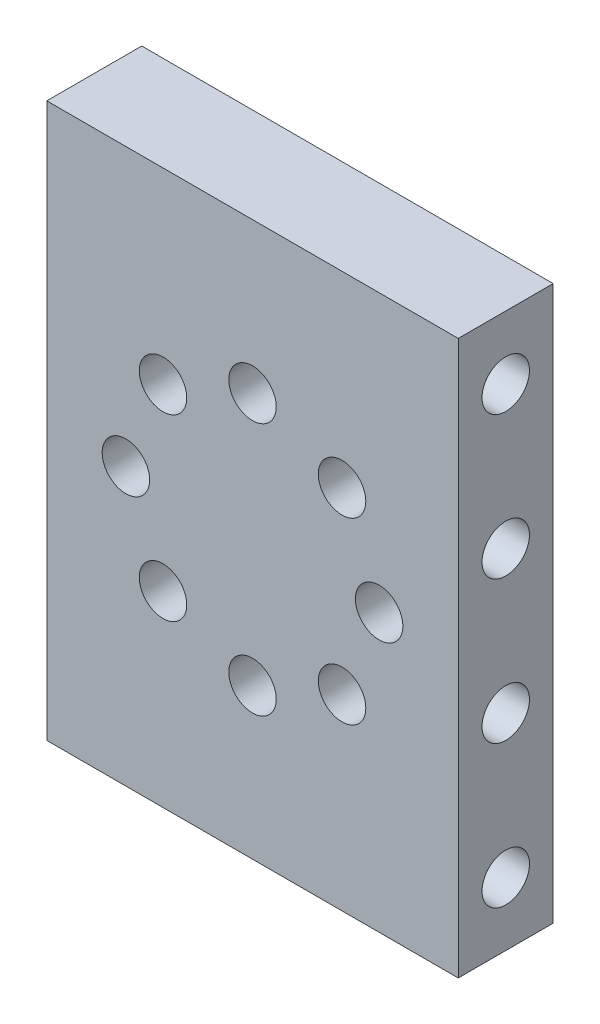
from build123d import *

# Parameters (mm, degrees)
SKETCH_1_W          = 52
SKETCH_1_H          = 70
EXTRUDE_1_DEPTH     = 12
SKETCH_2_R          = 3
CUT_EXTRUDE_1_DEPTH = 10
CUT_EXTRUDE_START   = -10
SKETCH_3_R          = 3
CUT_EXTRUDE_2_DEPTH = 10
SKETCH_4_R          = 3
CUT_EXTRUDE_3_DEPTH = 12


with BuildPart() as part:
    # 草图1 → 凸台-拉伸1 (new body)
    with BuildSketch(Plane.XY):
        Rectangle(SKETCH_1_W, SKETCH_1_H)
    extrude(amount=EXTRUDE_1_DEPTH)

    # 草图2 → 切除-拉伸1 (cut)
    with BuildSketch(Plane.ZY.offset(26)):
        with Locations((6, 27)):
            Circle(SKETCH_2_R)
        with Locations((6, 9)):
            Circle(SKETCH_2_R)
        with Locations((6, -9)):
            Circle(SKETCH_2_R)
        with Locations((6, -27)):
            Circle(SKETCH_2_R)
    extrude(amount=-CUT_EXTRUDE_1_DEPTH, mode=Mode.SUBTRACT)

    # 草图3 → 切除-拉伸2 (cut)
    with BuildSketch(Plane(origin=(26, 0, 0), x_dir=(0, 0, -1), z_dir=(1, 0, 0)).offset(CUT_EXTRUDE_START)):
        with Locations(Location((-6, 27, 0), (0, 0, 180))):
            Circle(SKETCH_3_R)
        with Locations(Location((-6, 9, 0), (0, 0, 180))):
            Circle(SKETCH_3_R)
        with Locations(Location((-6, -9, 0), (0, 0, 180))):
            Circle(SKETCH_3_R)
        with Locations(Location((-6, -27, 0), (0, 0, 180))):
            Circle(SKETCH_3_R)
    extrude(amount=CUT_EXTRUDE_2_DEPTH, mode=Mode.SUBTRACT)

    # 草图4 → 切除-拉伸3 (cut)
    with BuildSketch(Plane.XY.offset(12)):
        with Locations((16, 0)):
            Circle(SKETCH_4_R)
        with Locations((11.313708499, -11.313708499)):
            Circle(SKETCH_4_R)
        with Locations((0, -16)):
            Circle(SKETCH_4_R)
        with Locations((-11.313708499, -11.313708499)):
            Circle(SKETCH_4_R)
        with Locations((-16, 0)):
            Circle(SKETCH_4_R)
        with Locations((-11.313708499, 11.313708499)):
            Circle(SKETCH_4_R)
        with Locations((0, 16)):
            Circle(SKETCH_4_R)
        with Locations((11.313708499, 11.313708499)):
            Circle(SKETCH_4_R)
    extrude(amount=-CUT_EXTRUDE_3_DEPTH, mode=Mode.SUBTRACT)


solid = part.part
